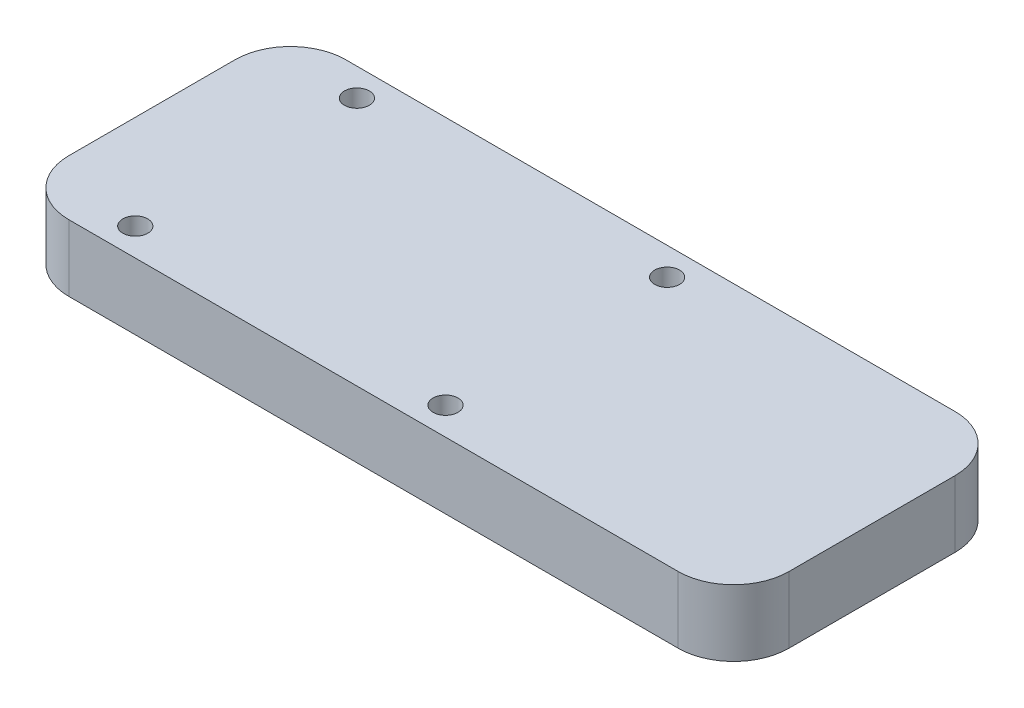
from build123d import *

# Parameters (mm, degrees)
CROQUIS1_R              = 2.25
SALIENTE_EXTRUIR1_DEPTH = 12


with BuildPart() as part:
    # Croquis1 → Saliente-Extruir1 (new body)
    with BuildSketch(Plane(origin=(0, 0, 0), x_dir=(1, 0, 0), z_dir=(0, 1, 0))):
        with BuildLine():
            Line((-92.582781457, 33.21192053), (-92.582781457, 3.21192053))
            ThreePointArc((-92.582781457, 3.21192053), (-89.653849269, -3.859147282), (-82.582781457, -6.78807947))
            Line((-82.582781457, -6.78807947), (27.417218543, -6.78807947))
            ThreePointArc((27.417218543, -6.78807947), (34.488286355, -3.859147282), (37.417218543, 3.21192053))
            Line((37.417218543, 3.21192053), (37.417218543, 33.21192053))
            ThreePointArc((37.417218543, 33.21192053), (34.488286355, 40.282988342), (27.417218543, 43.21192053))
            Line((27.417218543, 43.21192053), (-82.582781457, 43.21192053))
            ThreePointArc((-82.582781457, 43.21192053), (-89.653849269, 40.282988342), (-92.582781457, 33.21192053))
        make_face()
        with Locations(Location((-19.582781457, -1.78807947, 0), (0, 0, 270))):
            Circle(CROQUIS1_R, mode=Mode.SUBTRACT)
        with Locations(Location((-19.582781457, 38.21192053, 0), (0, 0, 270))):
            Circle(CROQUIS1_R, mode=Mode.SUBTRACT)
        with Locations(Location((-75.582781457, 38.21192053, 0), (0, 0, 270))):
            Circle(CROQUIS1_R, mode=Mode.SUBTRACT)
        with Locations(Location((-75.582781457, -1.78807947, 0), (0, 0, 270))):
            Circle(CROQUIS1_R, mode=Mode.SUBTRACT)
    extrude(amount=SALIENTE_EXTRUIR1_DEPTH)


solid = part.part
